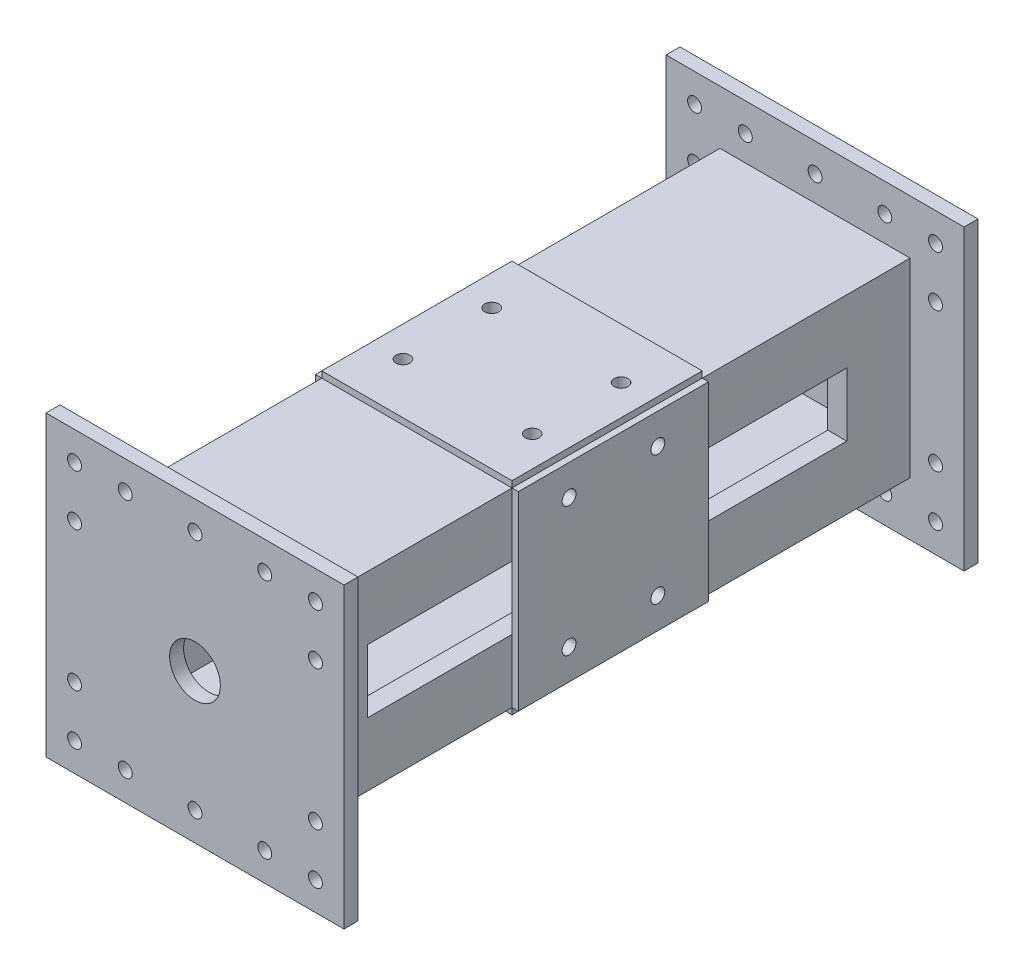
from build123d import *

# Parameters (mm, degrees)
SKETCH_1_W          = 300
SKETCH_1_H          = 300
EXTRUDE_1_DEPTH     = 956
SKETCH_2_W          = 240
SKETCH_2_H          = 240
CUT_EXTRUDE_1_DEPTH = 1046.913954396
SKETCH_4_W          = 756
SKETCH_4_H          = 100
CUT_EXTRUDE_2_DEPTH = 1046.913954396
SKETCH_5_W          = 470
SKETCH_5_H          = 470
EXTRUDE_2_DEPTH     = 22
SKETCH_6_W          = 470
SKETCH_6_H          = 470
EXTRUDE_3_DEPTH     = 22
SKETCH_7_R          = 11
CUT_EXTRUDE_3_DEPTH = 1139.617582861
SKETCH_9_W          = 300
SKETCH_9_H          = 300
EXTRUDE_4_DEPTH     = 10
SKETCH_10_W         = 300
SKETCH_10_H         = 300
EXTRUDE_5_DEPTH     = 10
SKETCH_11_W         = 300
SKETCH_11_H         = 300
EXTRUDE_6_DEPTH     = 10
SKETCH_12_W         = 300
SKETCH_12_H         = 300
EXTRUDE_7_DEPTH     = 10
SKETCH_13_R         = 11
CUT_EXTRUDE_4_DEPTH = 1123.824118017
SKETCH_14_R         = 11
CUT_EXTRUDE_5_DEPTH = 1123.824118017
SKETCH_15_R         = 40
CUT_EXTRUDE_6_DEPTH = 1139.617582861


with BuildPart() as part:
    # 草图1 → 拉伸1 (new body)
    with BuildSketch(Plane.XY):
        with Locations((150, 150)):
            Rectangle(SKETCH_1_W, SKETCH_1_H)
    extrude(amount=EXTRUDE_1_DEPTH)

    # 草图2 → 切除-拉伸1 (cut, through all)
    with BuildSketch(Plane.XY.offset(956)):
        with Locations((150, 150)):
            Rectangle(SKETCH_2_W, SKETCH_2_H)
    extrude(amount=-CUT_EXTRUDE_1_DEPTH, mode=Mode.SUBTRACT)

    # 草图4 → 切除-拉伸2 (cut, through all)
    with BuildSketch(Plane.ZY):
        with Locations((478, 150)):
            Rectangle(SKETCH_4_W, SKETCH_4_H)
    extrude(amount=-CUT_EXTRUDE_2_DEPTH, mode=Mode.SUBTRACT)

    # 草图5 → 拉伸2 (add)
    with BuildSketch(Plane.XY.offset(956)):
        with Locations((150, 150)):
            Rectangle(SKETCH_5_W, SKETCH_5_H)
    extrude(amount=EXTRUDE_2_DEPTH)

    # 草图6 → 拉伸3 (add)
    with BuildSketch(Plane(origin=(0, 0, 0), x_dir=(-1, 0, 0), z_dir=(0, 0, -1))):
        with Locations((-150, 150)):
            Rectangle(SKETCH_6_W, SKETCH_6_H)
    extrude(amount=EXTRUDE_3_DEPTH)

    # 草图7 → 切除-拉伸3 (cut, through all)
    with BuildSketch(Plane.XY.offset(978)):
        with Locations((-40, -40)):
            Circle(SKETCH_7_R)
        with Locations((40, -40)):
            Circle(SKETCH_7_R)
        with Locations((150, -40)):
            Circle(SKETCH_7_R)
        with Locations((260, -40)):
            Circle(SKETCH_7_R)
        with Locations((340, -40)):
            Circle(SKETCH_7_R)
        with Locations((-40, 340)):
            Circle(SKETCH_7_R)
        with Locations((40, 340)):
            Circle(SKETCH_7_R)
        with Locations((150, 340)):
            Circle(SKETCH_7_R)
        with Locations((260, 340)):
            Circle(SKETCH_7_R)
        with Locations((340, 340)):
            Circle(SKETCH_7_R)
        with Locations((-40, 40)):
            Circle(SKETCH_7_R)
        with Locations((-40, 260)):
            Circle(SKETCH_7_R)
        with Locations((340, 40)):
            Circle(SKETCH_7_R)
        with Locations((340, 260)):
            Circle(SKETCH_7_R)
    extrude(amount=-CUT_EXTRUDE_3_DEPTH, mode=Mode.SUBTRACT)

    # 草图9 → 拉伸4 (add)
    with BuildSketch(Plane(origin=(0, 300, 0), x_dir=(1, 0, 0), z_dir=(0, 1, 0))):
        with Locations((150, -478)):
            Rectangle(SKETCH_9_W, SKETCH_9_H)
    extrude(amount=EXTRUDE_4_DEPTH)

    # 草图10 → 拉伸5 (add)
    with BuildSketch(Plane.XZ):
        with Locations((150, 478)):
            Rectangle(SKETCH_10_W, SKETCH_10_H)
    extrude(amount=EXTRUDE_5_DEPTH)

    # 草图11 → 拉伸6 (add)
    with BuildSketch(Plane(origin=(300, 0, 0), x_dir=(0, 0, -1), z_dir=(1, 0, 0))):
        with Locations((-478, 150)):
            Rectangle(SKETCH_11_W, SKETCH_11_H)
    extrude(amount=EXTRUDE_6_DEPTH)

    # 草图12 → 拉伸7 (add)
    with BuildSketch(Plane.ZY):
        with Locations((478, 150)):
            Rectangle(SKETCH_12_W, SKETCH_12_H)
    extrude(amount=EXTRUDE_7_DEPTH)

    # 草图13 → 切除-拉伸4 (cut, through all)
    with BuildSketch(Plane.ZY.offset(10)):
        with Locations((408, 48)):
            Circle(SKETCH_13_R)
        with Locations((408, 252)):
            Circle(SKETCH_13_R)
        with Locations((548, 252)):
            Circle(SKETCH_13_R)
        with Locations((548, 48)):
            Circle(SKETCH_13_R)
    extrude(amount=-CUT_EXTRUDE_4_DEPTH, mode=Mode.SUBTRACT)

    # 草图14 → 切除-拉伸5 (cut, through all)
    with BuildSketch(Plane(origin=(0, 310, 0), x_dir=(1, 0, 0), z_dir=(0, 1, 0))):
        with Locations(Location((48, -548, 0), (0, 0, 270))):
            Circle(SKETCH_14_R)
        with Locations(Location((252, -548, 0), (0, 0, 270))):
            Circle(SKETCH_14_R)
        with Locations(Location((252, -408, 0), (0, 0, 270))):
            Circle(SKETCH_14_R)
        with Locations(Location((48, -408, 0), (0, 0, 270))):
            Circle(SKETCH_14_R)
    extrude(amount=-CUT_EXTRUDE_5_DEPTH, mode=Mode.SUBTRACT)

    # 草图15 → 切除-拉伸6 (cut, through all)
    with BuildSketch(Plane.XY.offset(978)):
        with Locations((150, 150)):
            Circle(SKETCH_15_R)
    extrude(amount=-CUT_EXTRUDE_6_DEPTH, mode=Mode.SUBTRACT)


solid = part.part
